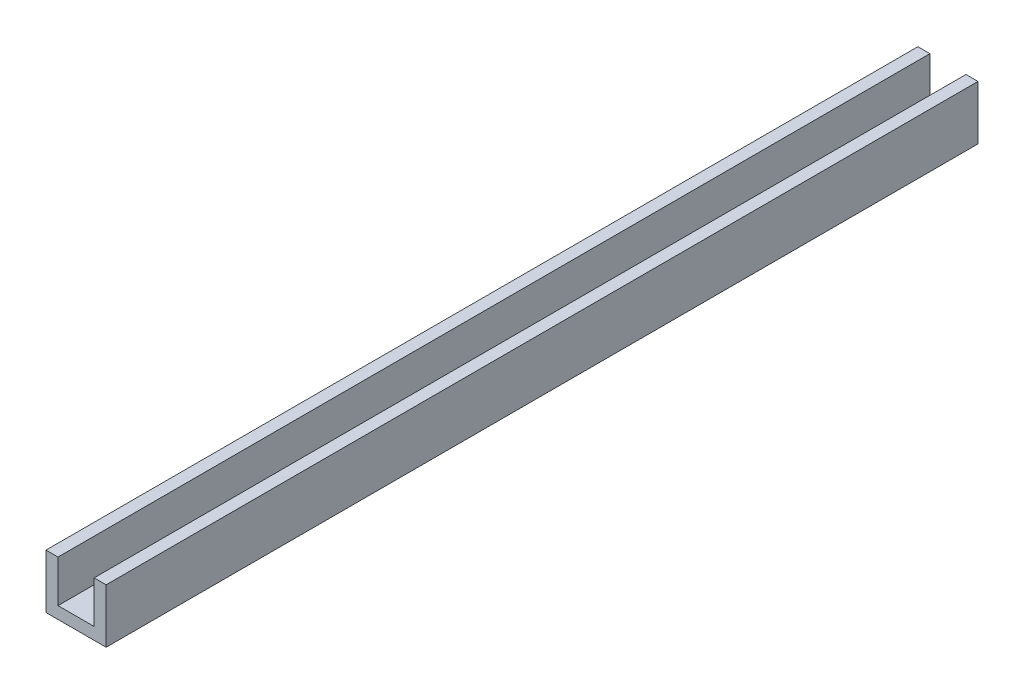
from build123d import *

# Parameters (mm, degrees)
EXTRUDE_1_DEPTH          = 245
SKETCH_2_R               = 2.5
CUT_EXTRUDE_1_DEPTH      = 246.21623111
CUT_EXTRUDE_2_DEPTH      = 246.21623111
CUT_EXTRUDE_2_DEPTH_BACK = 246.21623111
SKETCH_3_W               = 10
SKETCH_3_H               = 100


with BuildPart() as part:
    # ｽｹｯﾁ1 → ﾎﾞｽ - 押し出し1 (new body)
    with BuildSketch(Plane.XY):
        Polygon((-5, 9), (-5, 0), (5, 0), (5, 9), (3, 9), (3, 2), (-3, 2), (-3, 9), align=None)
    extrude(amount=EXTRUDE_1_DEPTH)

    # ｽｹｯﾁ2 → ｶｯﾄ - 押し出し1 (cut, through all)
    with BuildSketch(Plane.XZ):
        with Locations(Location((0, 225, 0), (0, 0, 270))):
            Circle(SKETCH_2_R)
        with Locations(Location((0, 217, 0), (0, 0, 270))):
            Circle(SKETCH_2_R)
        with Locations(Location((0, 122.5, 0), (0, 0, 270))):
            Circle(SKETCH_2_R)
        with Locations(Location((0, 209, 0), (0, 0, 270))):
            Circle(SKETCH_2_R)
        with Locations(Location((0, 193, 0), (0, 0, 270))):
            Circle(SKETCH_2_R)
        with Locations(Location((0, 161, 0), (0, 0, 270))):
            Circle(SKETCH_2_R)
    cut_extrude_1 = extrude(amount=-CUT_EXTRUDE_1_DEPTH, mode=Mode.SUBTRACT)

    # ﾐﾗｰ1: ｶｯﾄ - 押し出し1 across plane
    add(cut_extrude_1.mirror(Plane.XY.offset(122.5)), mode=Mode.SUBTRACT)

    # ｽｹｯﾁ3 → ｶｯﾄ - 押し出し2 (cut, two sides: drawn at the far end of the back side and taken through both)
    with BuildSketch(Plane.XZ.offset(-CUT_EXTRUDE_2_DEPTH_BACK)):
        with Locations((0, 50)):
            Rectangle(SKETCH_3_W, SKETCH_3_H)
    extrude(amount=CUT_EXTRUDE_2_DEPTH + CUT_EXTRUDE_2_DEPTH_BACK, mode=Mode.SUBTRACT)


solid = part.part
